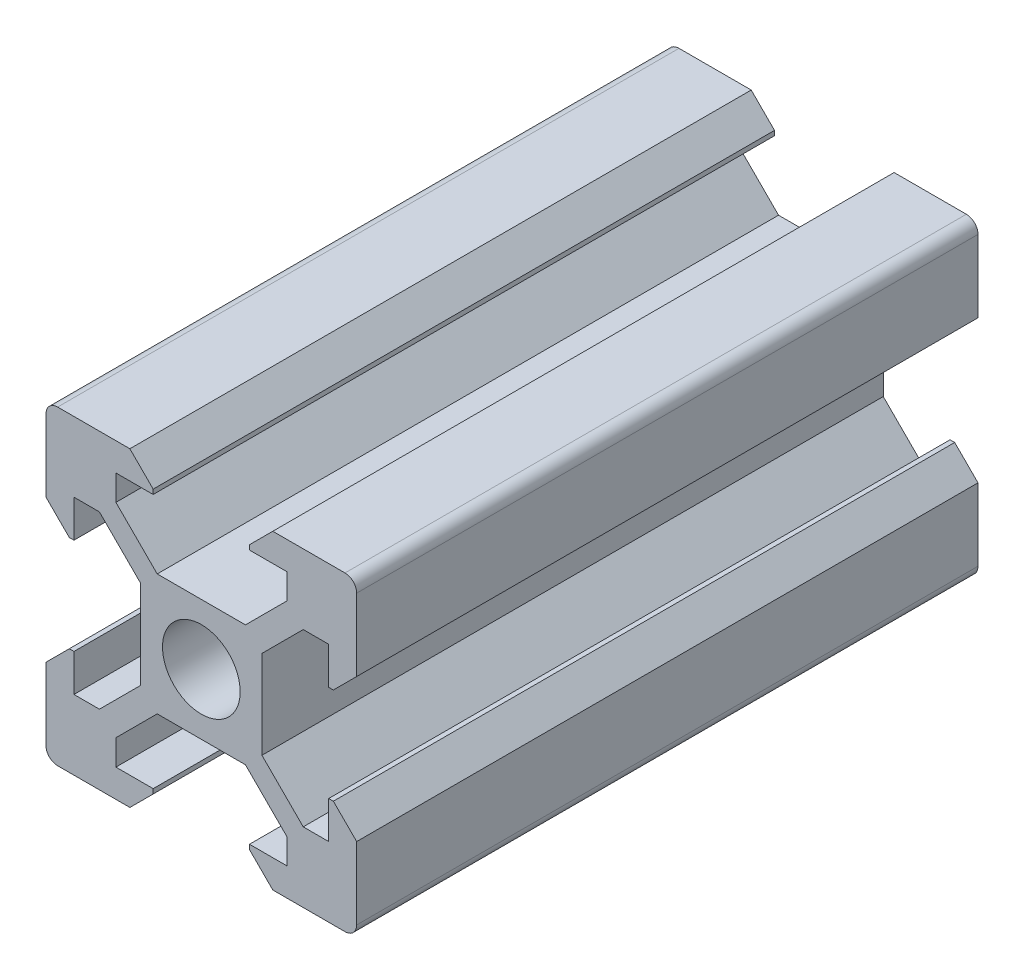
from build123d import *

# Parameters (mm, degrees)
CROQUIS1_R              = 2.5
SALIENTE_EXTRUIR1_DEPTH = 480
CUT_EXTRUDE1_DEPTH      = 47
CUT_EXTRUDE1_DEPTH_BACK = 46
SKETCH2_W               = 880
SKETCH2_H               = 37.408865396


with BuildPart() as part:
    # Croquis1 → Saliente-Extruir1 (new body)
    with BuildSketch(Plane.XY):
        with BuildLine():
            Line((-4.6, 10), (-3.1, 8.5))
            Line((-3.1, 8.5), (-3.1, 8.2))
            Line((-3.1, 8.2), (-5.5, 8.2))
            Line((-5.5, 8.2), (-5.5, 6.560660172))
            Line((-5.5, 6.560660172), (-2.84, 3.900660172))
            Line((-2.84, 3.900660172), (0, 3.900660172))
            Line((0, 3.900660172), (2.84, 3.900660172))
            Line((2.84, 3.900660172), (5.5, 6.560660172))
            Line((5.5, 6.560660172), (5.5, 8.2))
            Line((5.5, 8.2), (3.1, 8.2))
            Line((3.1, 8.2), (3.1, 8.5))
            Line((3.1, 8.5), (4.6, 10))
            Line((4.6, 10), (9.25, 10))
            ThreePointArc((9.25, 10), (9.780330086, 9.780330086), (10, 9.25))
            Line((10, 9.25), (10, 4.6))
            Line((10, 4.6), (8.5, 3.1))
            Line((8.5, 3.1), (8.2, 3.1))
            Line((8.2, 3.1), (8.2, 5.5))
            Line((8.2, 5.5), (6.560660172, 5.5))
            Line((6.560660172, 5.5), (3.900660172, 2.84))
            Line((3.900660172, 2.84), (3.900660172, 0))
            Line((3.900660172, 0), (3.900660172, -2.84))
            Line((3.900660172, -2.84), (6.560660172, -5.5))
            Line((6.560660172, -5.5), (8.2, -5.5))
            Line((8.2, -5.5), (8.2, -3.1))
            Line((8.2, -3.1), (8.5, -3.1))
            Line((8.5, -3.1), (10, -4.6))
            Line((10, -4.6), (10, -9.25))
            ThreePointArc((10, -9.25), (9.780330086, -9.780330086), (9.25, -10))
            Line((9.25, -10), (4.6, -10))
            Line((4.6, -10), (3.1, -8.5))
            Line((3.1, -8.5), (3.1, -8.2))
            Line((3.1, -8.2), (5.5, -8.2))
            Line((5.5, -8.2), (5.5, -6.560660172))
            Line((5.5, -6.560660172), (2.84, -3.900660172))
            Line((2.84, -3.900660172), (0, -3.900660172))
            Line((0, -3.900660172), (-2.84, -3.900660172))
            Line((-2.84, -3.900660172), (-5.5, -6.560660172))
            Line((-5.5, -6.560660172), (-5.5, -8.2))
            Line((-5.5, -8.2), (-3.1, -8.2))
            Line((-3.1, -8.2), (-3.1, -8.5))
            Line((-3.1, -8.5), (-4.6, -10))
            Line((-4.6, -10), (-9.25, -10))
            ThreePointArc((-9.25, -10), (-9.780330086, -9.780330086), (-10, -9.25))
            Line((-10, -9.25), (-10, -4.6))
            Line((-10, -4.6), (-8.5, -3.1))
            Line((-8.5, -3.1), (-8.2, -3.1))
            Line((-8.2, -3.1), (-8.2, -5.5))
            Line((-8.2, -5.5), (-6.560660172, -5.5))
            Line((-6.560660172, -5.5), (-3.900660172, -2.84))
            Line((-3.900660172, -2.84), (-3.900660172, 0))
            Line((-3.900660172, 0), (-3.900660172, 2.84))
            Line((-3.900660172, 2.84), (-6.560660172, 5.5))
            Line((-6.560660172, 5.5), (-8.2, 5.5))
            Line((-8.2, 5.5), (-8.2, 3.1))
            Line((-8.2, 3.1), (-8.5, 3.1))
            Line((-8.5, 3.1), (-10, 4.6))
            Line((-10, 4.6), (-10, 9.25))
            ThreePointArc((-10, 9.25), (-9.780330086, 9.780330086), (-9.25, 10))
            Line((-9.25, 10), (-4.6, 10))
        make_face()
        Circle(CROQUIS1_R, mode=Mode.SUBTRACT)
    extrude(amount=SALIENTE_EXTRUIR1_DEPTH)

    # Sketch2 → Cut-Extrude1 (cut, two sides: drawn at the far end of the back side and taken through both)
    with BuildSketch(Plane(origin=(0, 0, 0), x_dir=(0, 0, -1), z_dir=(1, 0, 0)).offset(-CUT_EXTRUDE1_DEPTH_BACK)):
        Rectangle(SKETCH2_W, SKETCH2_H)
    extrude(amount=CUT_EXTRUDE1_DEPTH + CUT_EXTRUDE1_DEPTH_BACK, mode=Mode.SUBTRACT)


solid = part.part
